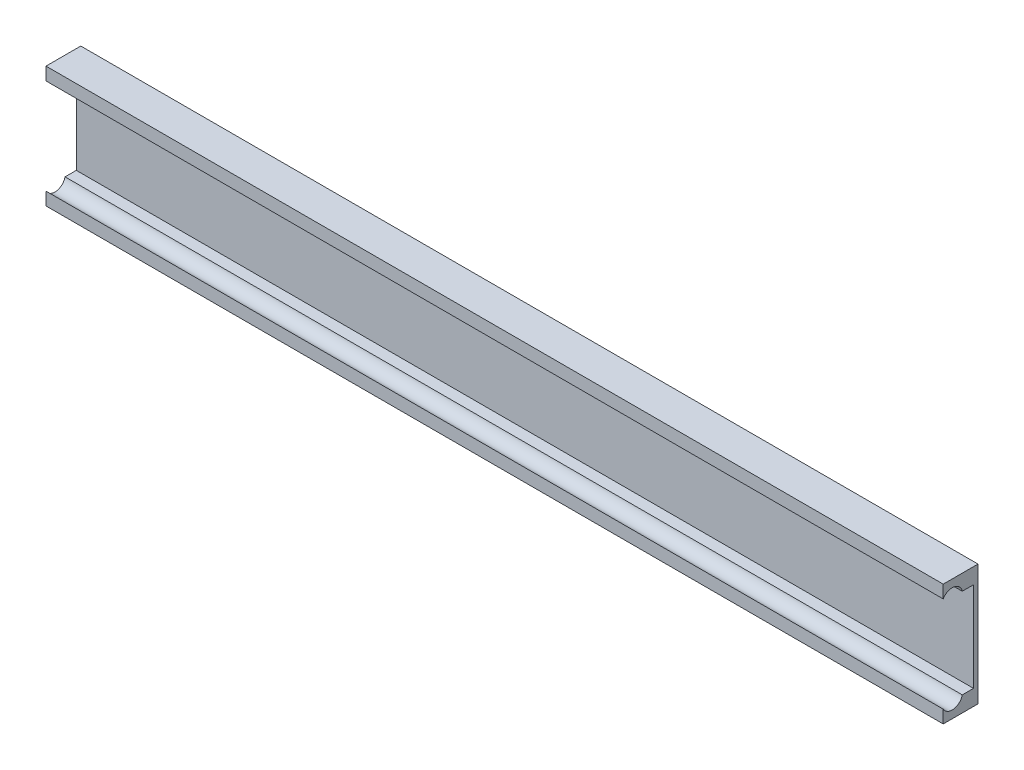
from build123d import *

# Parameters (mm, degrees)
SKETCH1_W           = 200
SKETCH1_H           = 27
BOSS_EXTRUDE1_DEPTH = 1
SKETCH2_W           = 200
SKETCH2_H           = 3.5
BOSS_EXTRUDE2_DEPTH = 6.75
SKETCH3_R           = 2.3
TOP_SLOT_DEPTH      = 102.132648042


with BuildPart() as part:
    # Sketch1 → Boss-Extrude1 (new body)
    with BuildSketch(Plane.XY):
        Rectangle(SKETCH1_W, SKETCH1_H)
    extrude(amount=-BOSS_EXTRUDE1_DEPTH)

    # Sketch2 → Boss-Extrude2 (add)
    with BuildSketch(Plane.XY):
        with Locations((0, 11.75)):
            Rectangle(SKETCH2_W, SKETCH2_H)
        with Locations((0, -11.75)):
            Rectangle(SKETCH2_W, SKETCH2_H)
    extrude(amount=BOSS_EXTRUDE2_DEPTH)

    # Sketch3 → Top Slot (cut, symmetric)
    with BuildSketch(Plane(origin=(0, 0, 0), x_dir=(0, 0, -1), z_dir=(1, 0, 0))):
        with Locations((-4.75, 9.5)):
            Circle(SKETCH3_R)
    top_slot = extrude(amount=TOP_SLOT_DEPTH, both=True, mode=Mode.SUBTRACT)

    # Bottom Slot: Top Slot across plane
    add(top_slot.mirror(Plane.ZX), mode=Mode.SUBTRACT)


solid = part.part
